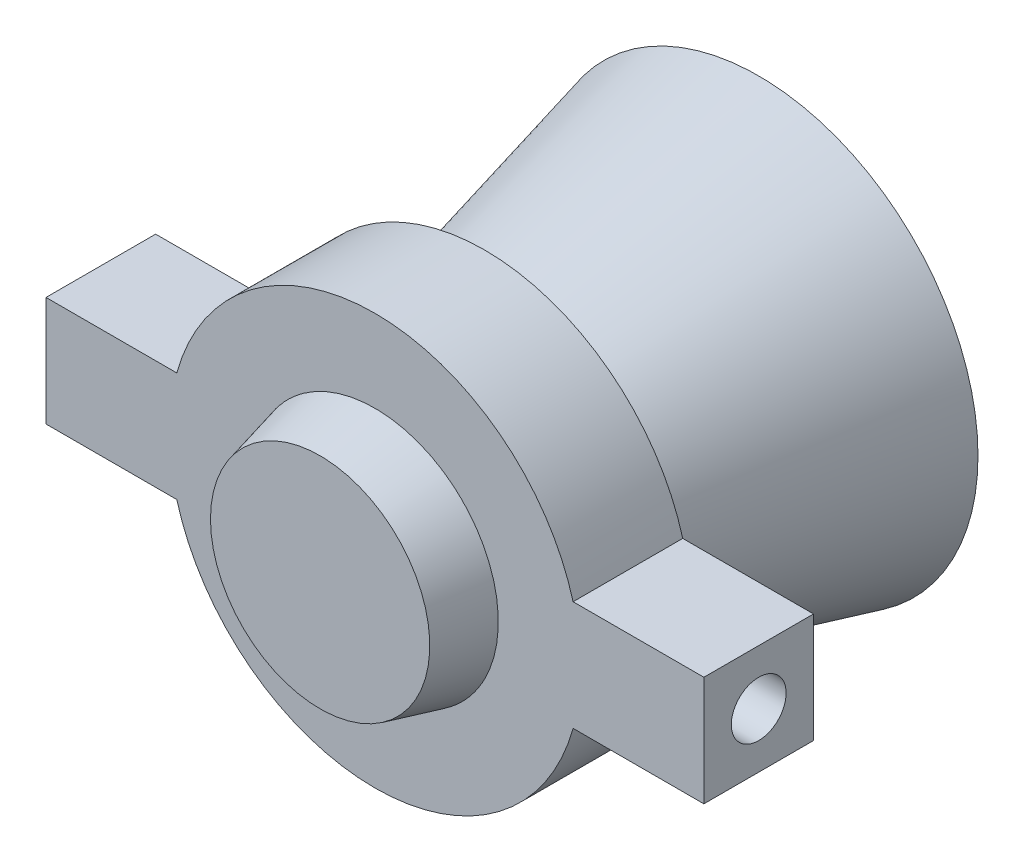
from build123d import *

# Parameters (mm, degrees)
BOSS_EXTRUDE2_REACH      = 102.317
BOSS_EXTRUDE2_END_RADIUS = 23.8125
BOSS_EXTRUDE2_START      = 38.1
SKETCH5_W                = 12.7
SKETCH5_H                = 12.7
SKETCH7_R                = 3.175
CUT_EXTRUDE3_DEPTH       = 19.05


with BuildPart() as part:
    # Sketch1 → Revolve1 (revolve)
    with BuildSketch(Plane.YZ, mode=Mode.PRIVATE) as revolve1_sk:
        Polygon((0, 50.8), (-12.7, 50.8), (-25.4, 0), (0, 0), align=None)
    revolve(revolve1_sk.sketch.rotate(Axis((0, 0, 0), (0, 0, 1)), 270), axis=Axis((0, 0, 0), (0, 0, 1)))


with BuildPart() as body_2:
    # Sketch4 → Revolve2 (revolve)
    with BuildSketch(Plane.YZ, mode=Mode.PRIVATE) as revolve2_sk:
        Polygon((-14.2875, 44.45), (-17.4625, 31.75), (-23.8125, 31.75), (-23.8125, 44.45), align=None)
    revolve(revolve2_sk.sketch.rotate(Axis((0, 0, 0), (0, 0, 1)), 270), axis=Axis((0, 0, 0), (0, 0, 1)))

    # Boss-Extrude2: up to this cylinder (the profile starts outside it)
    boss_extrude2_end = Plane(origin=(0, 0, 38.1), z_dir=(0, 0, -1)) * Cylinder(BOSS_EXTRUDE2_END_RADIUS, 253.259, mode=Mode.PRIVATE)
    # Sketch5 → Boss-Extrude2 (add, up to the surface)
    with BuildSketch(Plane.YZ.offset(BOSS_EXTRUDE2_START), mode=Mode.PRIVATE) as boss_extrude2_sk1:
        with Locations((0, 38.1)):
            Rectangle(SKETCH5_W, SKETCH5_H)
    boss_extrude2_tool1 = extrude(boss_extrude2_sk1.sketch, amount=-BOSS_EXTRUDE2_REACH, mode=Mode.PRIVATE) - boss_extrude2_end
    boss_extrude2 = boss_extrude2_tool1.solids().sort_by_distance((38.1, 0, 38.1))[0]
    add(boss_extrude2)

    # Sketch7 → Cut-Extrude3 (cut)
    with BuildSketch(Plane.YZ.offset(38.1)):
        with Locations(Location((0, 38.1, 0), (0, 0, 270))):
            Circle(SKETCH7_R)
    cut_extrude3 = extrude(amount=-CUT_EXTRUDE3_DEPTH, mode=Mode.SUBTRACT)

    # Mirror3: Boss-Extrude2, Cut-Extrude3 across plane
    add(boss_extrude2.mirror(Plane(origin=(0, 0, 0), x_dir=(0, 0, 1), z_dir=(1, 0, 0))))
    add(cut_extrude3.mirror(Plane(origin=(0, 0, 0), x_dir=(0, 0, 1), z_dir=(1, 0, 0))), mode=Mode.SUBTRACT)


solid = Compound([part.part, body_2.part])
